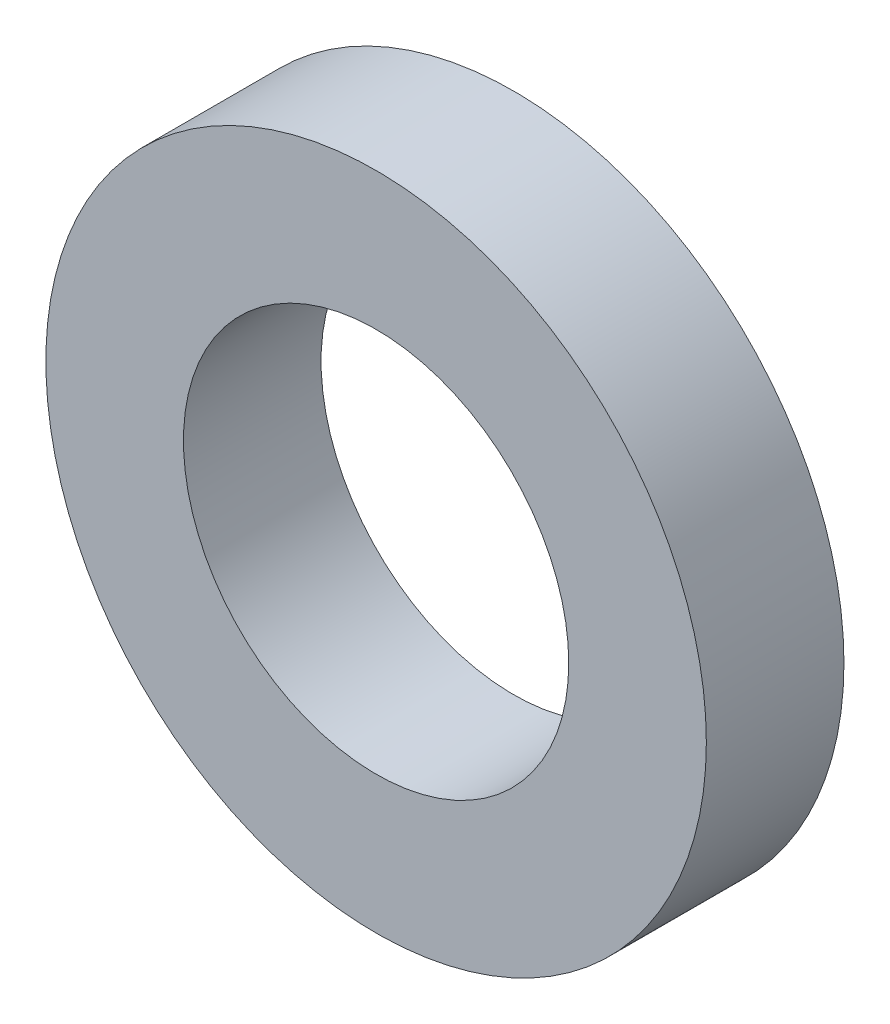
from build123d import *

# Parameters (mm, degrees)
SKETCH1_R           = 2.4
SKETCH1_R_2         = 1.4
BOSS_EXTRUDE1_DEPTH = 1


with BuildPart() as part:
    # Sketch1 → Boss-Extrude1 (new body)
    with BuildSketch(Plane.XY):
        Circle(SKETCH1_R)
        Circle(SKETCH1_R_2, mode=Mode.SUBTRACT)
    extrude(amount=BOSS_EXTRUDE1_DEPTH)


solid = part.part
